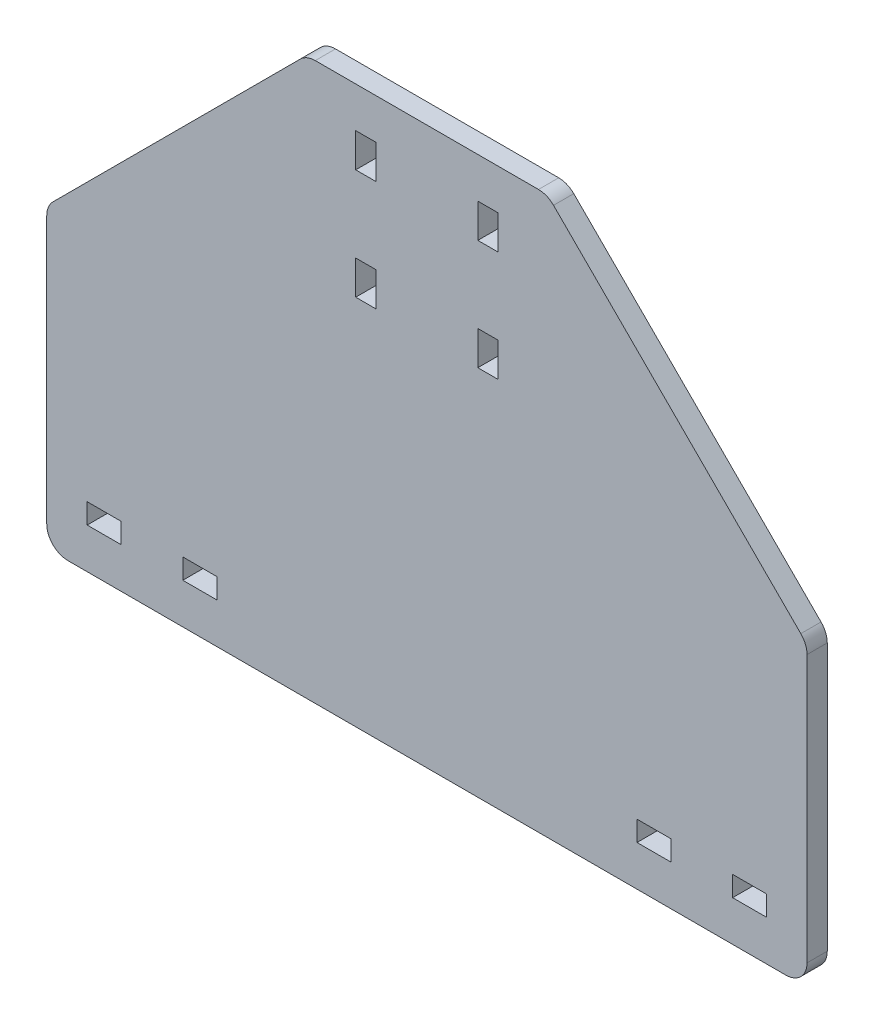
from build123d import *

# Parameters (mm, degrees)
SKETCH1_W           = 8
SKETCH1_H           = 4.7625
SKETCH1_W_2         = 4.7625
SKETCH1_H_2         = 8
BOSS_EXTRUDE1_DEPTH = 4.7625


with BuildPart() as part:
    # Sketch1 → Boss-Extrude1 (new body)
    with BuildSketch(Plane.XY):
        with BuildLine():
            Line((-17.823033906, 115.360533906), (-76.060533906, 57.123033906))
            ThreePointArc((-76.060533906, 57.123033906), (-77.144397663, 55.500917162), (-77.525, 53.5875))
            Line((-77.525, 53.5875), (-77.525, -9.2875))
            ThreePointArc((-77.525, -9.2875), (-76.060533906, -12.823033906), (-72.525, -14.2875))
            Line((-72.525, -14.2875), (96.525, -14.2875))
            ThreePointArc((96.525, -14.2875), (100.060533906, -12.823033906), (101.525, -9.2875))
            Line((101.525, -9.2875), (101.525, 53.5875))
            ThreePointArc((101.525, 53.5875), (101.144397663, 55.500917162), (100.060533906, 57.123033906))
            Line((100.060533906, 57.123033906), (41.823033906, 115.360533906))
            ThreePointArc((41.823033906, 115.360533906), (40.200917162, 116.444397663), (38.2875, 116.825))
            Line((38.2875, 116.825), (-14.2875, 116.825))
            ThreePointArc((-14.2875, 116.825), (-16.200917162, 116.444397663), (-17.823033906, 115.360533906))
        make_face()
        with Locations((-64, -2.38125)):
            Rectangle(SKETCH1_W, SKETCH1_H, mode=Mode.SUBTRACT)
        with Locations((-41.481563848, -2.38125)):
            Rectangle(SKETCH1_W, SKETCH1_H, mode=Mode.SUBTRACT)
        with Locations((65.481563848, -2.38125)):
            Rectangle(SKETCH1_W, SKETCH1_H, mode=Mode.SUBTRACT)
        with Locations((88, -2.38125)):
            Rectangle(SKETCH1_W, SKETCH1_H, mode=Mode.SUBTRACT)
        with Locations((-2.38125, 77.326723172)):
            Rectangle(SKETCH1_W_2, SKETCH1_H_2, mode=Mode.SUBTRACT)
        with Locations((-2.38125, 103.3)):
            Rectangle(SKETCH1_W_2, SKETCH1_H_2, mode=Mode.SUBTRACT)
        with Locations((26.38125, 77.326723172)):
            Rectangle(SKETCH1_W_2, SKETCH1_H_2, mode=Mode.SUBTRACT)
        with Locations((26.38125, 103.3)):
            Rectangle(SKETCH1_W_2, SKETCH1_H_2, mode=Mode.SUBTRACT)
    extrude(amount=BOSS_EXTRUDE1_DEPTH)


solid = part.part
